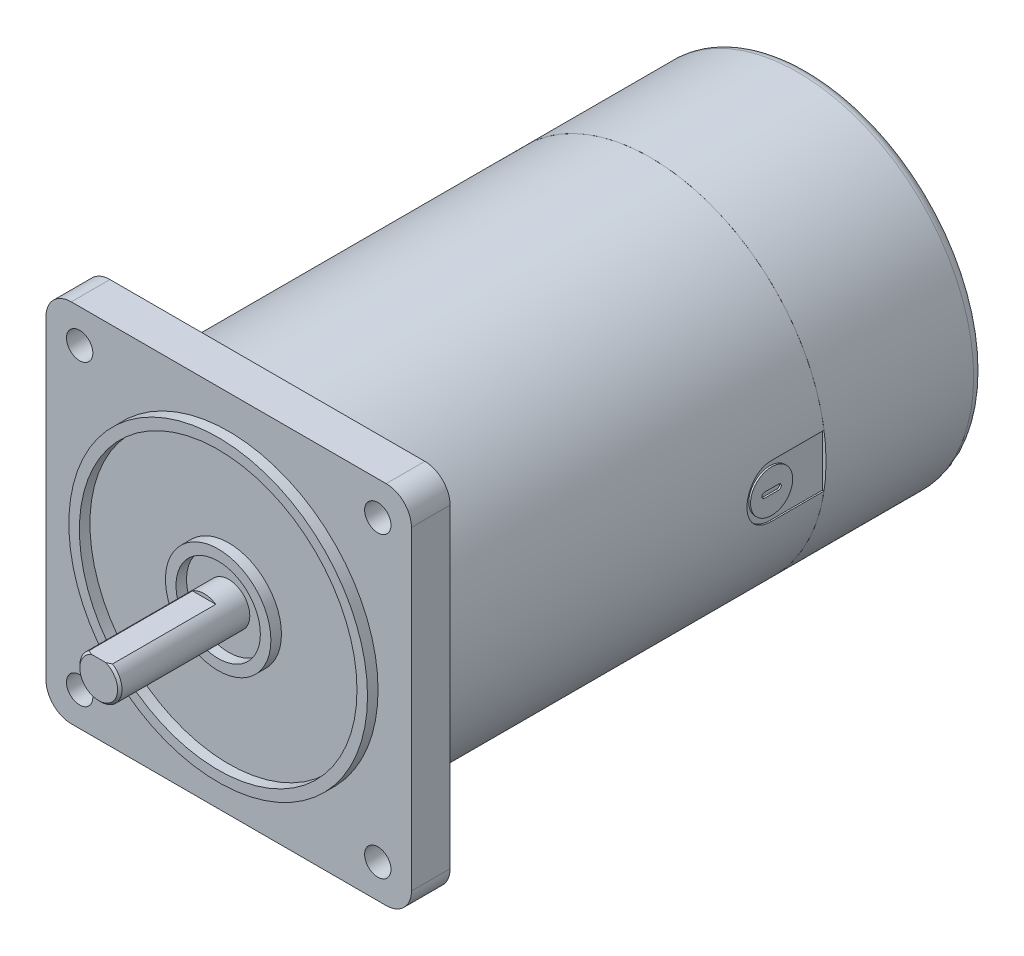
from build123d import *

# Parameters (mm, degrees)
SKETCH_3_W               = 104
SKETCH_3_H               = 104
EXTRUDE_1_DEPTH          = 11
SKETCH_4_R               = 3.75
CUT_EXTRUDE_1_DEPTH      = 11
PATTERN_CIRCULAR_1_COUNT = 4
FILLET_1_R               = 7.2
SKETCH_5_W               = 6.63324958
SKETCH_5_H               = 1
CUT_EXTRUDE_2_DEPTH      = 30
FILLET_2_R               = 3
CUT_EXTRUDE_START        = 50
CUT_EXTRUDE_3_DEPTH      = 1
SKETCH_7_R               = 6
EXTRUDE_2_DEPTH          = 0.5
CHAMFER_2_SIZE           = 0.62
MOVE_BODY_1_ANGLE        = 90


with BuildPart() as part:
    # 草图2 → 旋转1 (revolve)
    with BuildSketch(Plane.XY, mode=Mode.PRIVATE) as revolve_1_sk:
        Polygon((0, 15), (-3, 15), (-3, 12), (0, 12), (0, 6), (-37, 6), (-37, 0), (165, 0), (165, 50), (120, 50), (120, 42.5), (119.99, 42.5), (119.99, 50), (0, 50), (0, 42.5), (-3, 42.5), (-3, 39.5), (0, 39.5), align=None)
    revolve(revolve_1_sk.sketch.rotate(Axis((-37, 0, 0), (1, 0, 0)), 90), axis=Axis((-37, 0, 0), (1, 0, 0)))

    # 草图3 → 凸台-拉伸1 (add)
    with BuildSketch(Plane.ZY):
        Rectangle(SKETCH_3_W, SKETCH_3_H)
    extrude(amount=-EXTRUDE_1_DEPTH)

    # 草图4 → 切除-拉伸1 (cut)
    with BuildSketch(Plane.ZY):
        with Locations((42.426406871, 42.426406871)):
            Circle(SKETCH_4_R)
    cut_extrude_1 = extrude(amount=-CUT_EXTRUDE_1_DEPTH, mode=Mode.SUBTRACT)

    # 阵列(圆周)1: 切除-拉伸1 ×4 about axis
    pattern_circular_1_axis = Axis((0, 0, 0), (1, 0, 0))
    for i in range(1, PATTERN_CIRCULAR_1_COUNT):
        add(cut_extrude_1.rotate(pattern_circular_1_axis, i * 360 / PATTERN_CIRCULAR_1_COUNT), mode=Mode.SUBTRACT)

    # 圆角1
    fillet_1_edges = [part.edges().sort_by_distance(p)[0] for p in [
        (5.5, -52, -52),
        (5.5, 52, -52),
        (5.5, 52, 52),
        (5.5, -52, 52),
    ]]
    fillet(fillet_1_edges, radius=FILLET_1_R)

    # 草图5 → 切除-拉伸2 (cut)
    with BuildSketch(Plane.ZY.offset(37)):
        with Locations((0, 5.5)):
            Rectangle(SKETCH_5_W, SKETCH_5_H)
    extrude(amount=-CUT_EXTRUDE_2_DEPTH, mode=Mode.SUBTRACT)

    # 圆角2
    fillet_2_edges = [part.edges().sort_by_distance(p)[0] for p in [
        (165, 0, -50),
    ]]
    fillet(fillet_2_edges, radius=FILLET_2_R)

    # 草图6 → 切除-拉伸3 (cut)
    with BuildSketch(Plane.XY.offset(CUT_EXTRUDE_START)):
        with BuildLine():
            Line((105, 7.5), (120, 7.5))
            Line((120, 7.5), (120, -7.5))
            Line((120, -7.5), (105, -7.5))
            ThreePointArc((105, -7.5), (97.5, 0), (105, 7.5))
        make_face()
    extrude(amount=-CUT_EXTRUDE_3_DEPTH, mode=Mode.SUBTRACT)

    # 草图7 → 凸台-拉伸2 (add)
    with BuildSketch(Plane.XY.offset(49)):
        with Locations((105, 0)):
            Circle(SKETCH_7_R)
        with BuildLine():
            Line((103, 0.75), (107, 0.75))
            ThreePointArc((107, 0.75), (107.75, 0), (107, -0.75))
            Line((107, -0.75), (103, -0.75))
            ThreePointArc((103, -0.75), (102.25, 0), (103, 0.75))
        make_face(mode=Mode.SUBTRACT)
    extrude(amount=EXTRUDE_2_DEPTH)

    # 倒角2
    chamfer_2_edges = [part.edges().sort_by_distance(p)[0] for p in [
        (-37, -5.286764074, -2.837274331),
    ]]
    chamfer(chamfer_2_edges, length=CHAMFER_2_SIZE)


with BuildPart() as part_1:
    # Move Body 1: moved
    add(part.part.rotate(Axis((0, 0, 0), (0, 1, 0)), MOVE_BODY_1_ANGLE))


solid = part_1.part
